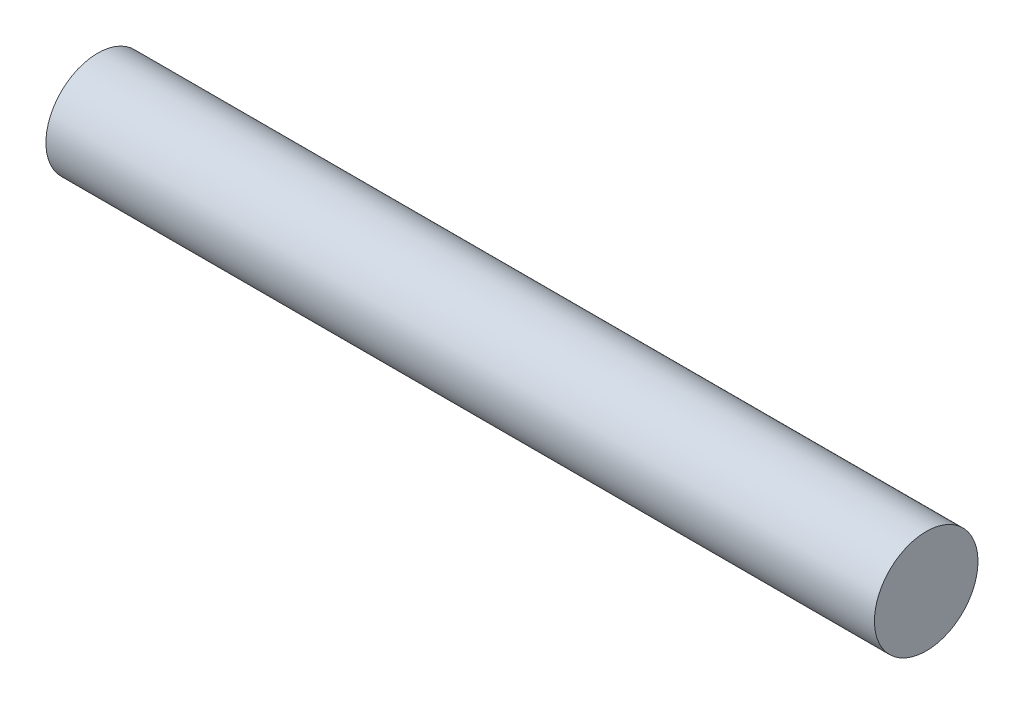
from build123d import *

# Parameters (mm, degrees)
SKETCH1_R           = 1.5875
BOSS_EXTRUDE1_DEPTH = 25.4


with BuildPart() as part:
    # Sketch1 → Boss-Extrude1 (new body)
    with BuildSketch(Plane(origin=(0, 0, 0), x_dir=(0, 0, -1), z_dir=(1, 0, 0))):
        Circle(SKETCH1_R)
    extrude(amount=BOSS_EXTRUDE1_DEPTH)


solid = part.part
